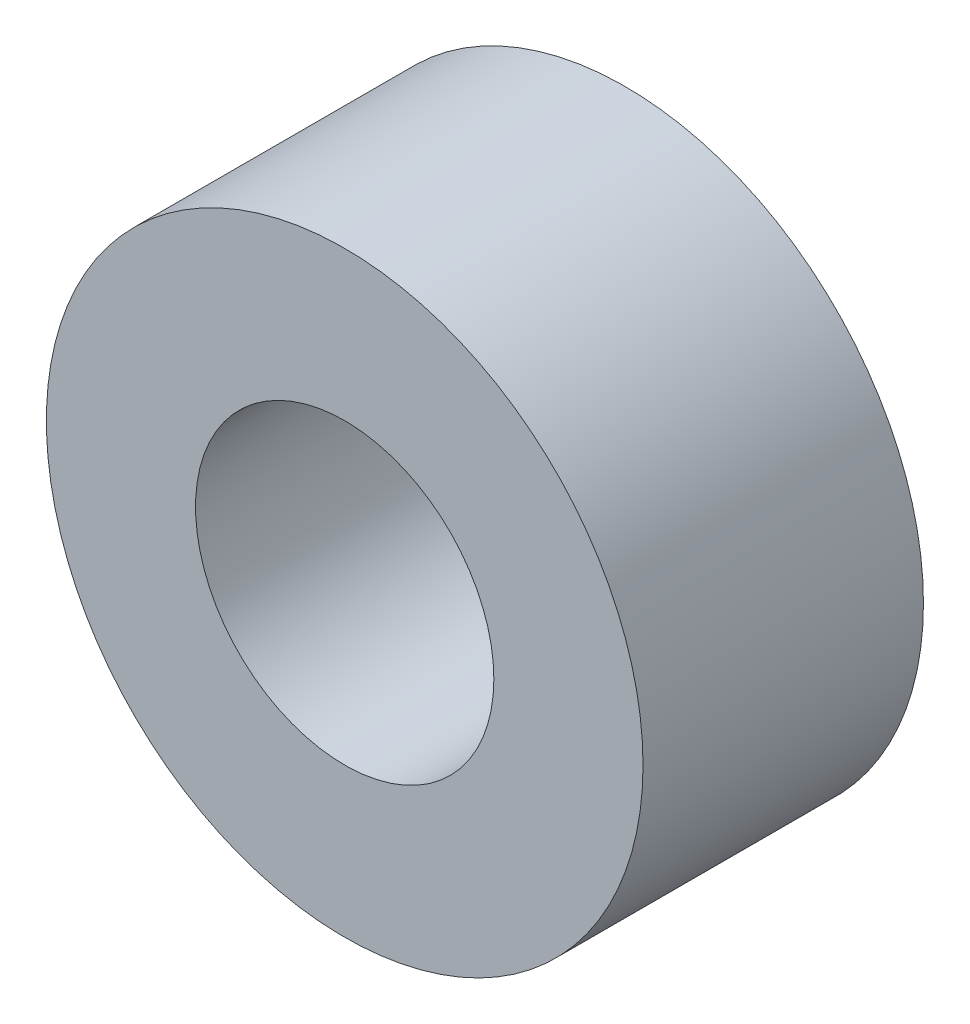
from build123d import *

# Parameters (mm, degrees)
SKETCH1_R           = 3.175
SKETCH1_R_2         = 1.5875
BOSS_EXTRUDE2_DEPTH = 2.9845


with BuildPart() as part:
    # Sketch1 → Boss-Extrude2 (new body)
    with BuildSketch(Plane.XY):
        Circle(SKETCH1_R)
        Circle(SKETCH1_R_2, mode=Mode.SUBTRACT)
    extrude(amount=BOSS_EXTRUDE2_DEPTH)


solid = part.part
